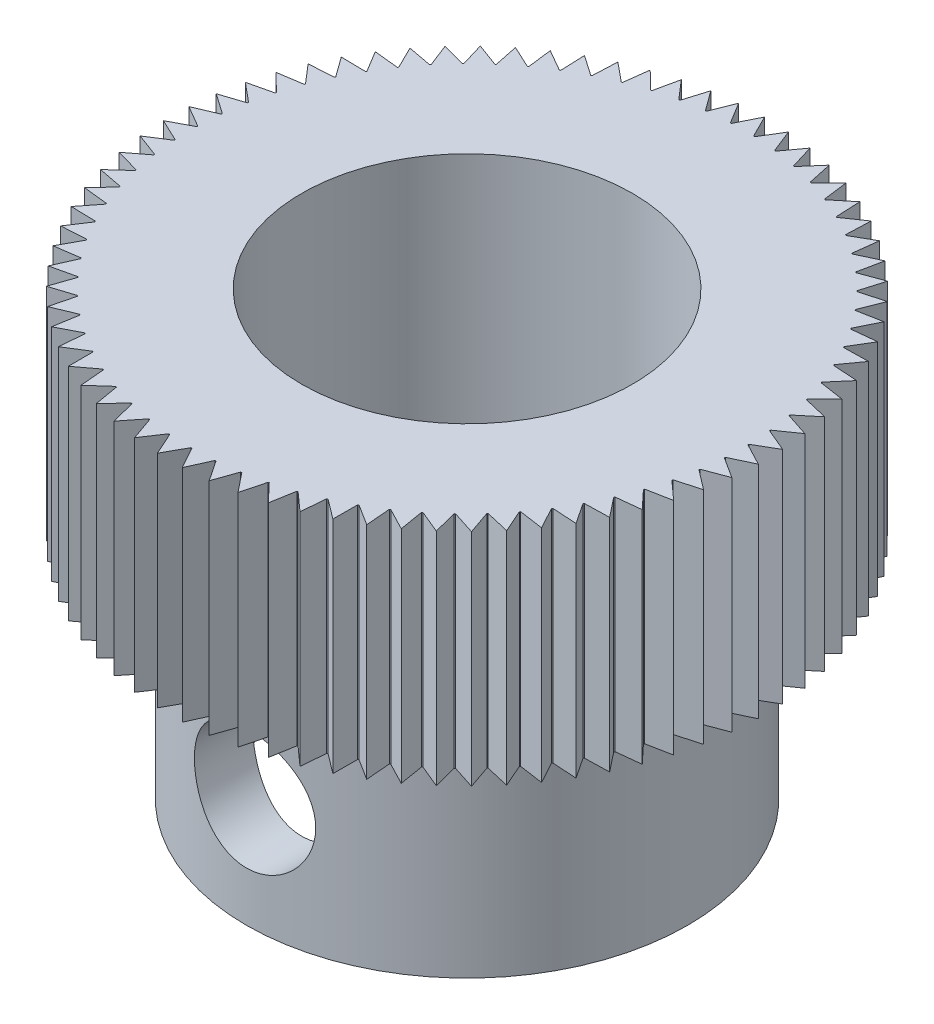
from build123d import *

# Parameters (mm, degrees)
SKETCH1_R           = 5
BOSS_EXTRUDE1_DEPTH = 4
BOSS_EXTRUDE2_DEPTH = 4
SKETCH5_R           = 4
BOSS_EXTRUDE3_DEPTH = 4
SKETCH7_R           = 3
CUT_EXTRUDE2_DEPTH  = 12.055352878
SKETCH_2_R          = 1.1
CUT_EXTRUDE_1_DEPTH = 12.549407536


with BuildPart() as part:
    # Sketch1 → Boss-Extrude1 (new body)
    with BuildSketch(Plane(origin=(0, 0, 0), x_dir=(1, 0, 0), z_dir=(0, 1, 0))):
        with Locations(Location((0, 0, 0), (0, 0, 270))):
            Circle(SKETCH1_R)
    extrude(amount=BOSS_EXTRUDE1_DEPTH)

    # Sketch3 → Boss-Extrude2 (add)
    with BuildSketch(Plane(origin=(0, 4, 0), x_dir=(1, 0, 0), z_dir=(0, 1, 0))):
        Polygon((-0.2, 4.995998399), (0.2, 4.995998399), (0, 5.395998399), align=None)
        Polygon((0.218755799, 4.995212298), (0.451525509, 5.377073873), (0.617352943, 4.96174116), align=None)
        Polygon((0.635977184, 4.959388372), (0.89988389, 5.320433037), (1.030375599, 4.892680873), align=None)
        Polygon((1.048737646, 4.888777899), (1.341930233, 5.226473186), (1.43617091, 4.789301945), align=None)
        Polygon((1.454141966, 4.783876163), (1.774563899, 5.095853382), (1.831892515, 4.652329504), align=None)
        Polygon((1.849346526, 4.645418972), (2.194750275, 4.929489827), (2.214764709, 4.482724315), align=None)
        Polygon((2.231579248, 4.474377505), (2.599542054, 4.728549442), (2.58210192, 4.281676035), align=None)
        Polygon((2.598159046, 4.271951495), (2.986099914, 4.494441681), (2.931327542, 4.050594875), align=None)
        Polygon((2.946514624, 4.039560814), (3.351712428, 4.228808641), (3.259992007, 3.791101702), align=None)
        Polygon((3.27420252, 3.778835516), (3.693815087, 3.933513546), (3.565789971, 3.505016674), align=None)
        Polygon((3.578924237, 3.491604403), (4.010008288, 3.61062768), (3.846576479, 3.194346473), align=None)
        Polygon((3.858542372, 3.179882193), (4.298074162, 3.262415856), (4.100382018, 2.861270226), align=None)
        Polygon((4.111095605, 2.845855395), (4.555992134, 2.891320528), (4.325426323, 2.508124225), align=None)
        Polygon((4.334812456, 2.491866965), (4.781953094, 2.499944664), (4.52013087, 2.137385534), align=None)
        Polygon((4.528123712, 2.12039988), (4.97437209, 2.091033484), (4.683129946, 1.751654619), align=None)
        Polygon((4.689673434, 1.734059712), (5.131899439, 1.667455207), (4.813280231, 1.353637106), align=None)
        Polygon((4.818328466, 1.335556362), (5.253430201, 1.232180929), (4.909668814, 0.946124801), align=None)
        Polygon((4.913186386, 0.927685043), (5.338111925, 0.788263788), (4.971619597, 0.53197611), align=None)
        Polygon((4.973581833, 0.513306681), (5.385350628, 0.338817543), (4.998698041, 0.114095989), align=None)
        Polygon((4.999091178, 0.09532784), (5.394814967, -0.113005264), (4.99071421, -0.304584433), align=None)
        Polygon((4.989535489, -0.323319656), (5.366438555, -0.56403542), (4.947724104, -0.721128414), align=None)
        Polygon((4.944981795, -0.739699297), (5.300420432, -1.011109273), (4.870029269, -1.132614198), align=None)
        Polygon((4.865742606, -1.15089048), (5.197223668, -1.451090921), (4.758174677, -1.536155507), align=None)
        Polygon((4.752373728, -1.554008992), (5.057572114, -1.880894209), (4.612944909, -1.928921788), align=None)
        Polygon((4.605670364, -1.946227248), (4.882445326, -2.297504375), (4.435358647, -2.308158069), align=None)
        Polygon((4.426661531, -2.324794119), (4.673071692, -2.697999199), (4.226661531, -2.67120428), align=None)
        Polygon((4.216602847, -2.687054228), (4.430919818, -3.079569497), (3.98831742, -3.015513912), align=None)
        Polygon((3.976967725, -3.030466584), (4.157688224, -3.439538828), (3.721998129, -3.338671881), align=None)
        Polygon((3.709437031, -3.352622393), (3.855293435, -3.775382265), (3.429571695, -3.638411465), align=None)
        Polygon((3.415887302, -3.651261965), (3.525856533, -4.084744108), (3.11308928, -3.912630207), align=None)
        Polygon((3.098377578, -3.924290558), (3.17168828, -4.365454406), (2.77477078, -4.159404659), align=None)
        Polygon((2.759134961, -4.169793072), (2.795272913, -4.615544178), (2.416989257, -4.377003876), align=None)
        Polygon((2.400538995, -4.386047484), (2.399250715, -4.833259224), (2.042254291, -4.563901556), align=None)
        Polygon((2.025104973, -4.571536924), (1.986399497, -5.017072429), (1.653194379, -4.718786745), align=None)
        Polygon((1.635466294, -4.724960317), (1.559615113, -5.165694476), (1.252538495, -4.840573036), align=None)
        Polygon((1.234355995, -4.845241509), (1.121891151, -5.278082887), (0.843096954, -4.928406185), align=None)
        Polygon((0.824587574, -4.931536812), (0.676297928, -5.35344934), (0.427741694, -4.981670106), align=None)
        Polygon((0.409035265, -4.983240929), (0.22596096, -5.391265191), (0.009386133, -4.99999119), align=None)
        Polygon((-0.009386133, -4.99999119), (-0.22596096, -5.391265191), (-0.409035265, -4.983240929), align=None)
        Polygon((-0.427741694, -4.981670106), (-0.676297928, -5.35344934), (-0.824587574, -4.931536812), align=None)
        Polygon((-0.843096954, -4.928406185), (-1.121891151, -5.278082887), (-1.234355995, -4.845241509), align=None)
        Polygon((-1.252538495, -4.840573036), (-1.559615113, -5.165694476), (-1.635466294, -4.724960317), align=None)
        Polygon((-1.653194379, -4.718786745), (-1.986399497, -5.017072429), (-2.025104973, -4.571536924), align=None)
        Polygon((-2.042254291, -4.563901556), (-2.399250715, -4.833259224), (-2.400538995, -4.386047484), align=None)
        Polygon((-2.416989257, -4.377003876), (-2.795272913, -4.615544178), (-2.759134961, -4.169793072), align=None)
        Polygon((-2.77477078, -4.159404659), (-3.17168828, -4.365454406), (-3.098377578, -3.924290558), align=None)
        Polygon((-3.11308928, -3.912630207), (-3.525856533, -4.084744108), (-3.415887302, -3.651261965), align=None)
        Polygon((-3.429571695, -3.638411465), (-3.855293435, -3.775382265), (-3.709437031, -3.352622393), align=None)
        Polygon((-3.721998129, -3.338671881), (-4.157688224, -3.439538828), (-3.976967725, -3.030466584), align=None)
        Polygon((-3.98831742, -3.015513912), (-4.430919818, -3.079569497), (-4.216602847, -2.687054228), align=None)
        Polygon((-4.226661531, -2.67120428), (-4.673071692, -2.697999199), (-4.426661531, -2.324794119), align=None)
        Polygon((-4.435358647, -2.308158069), (-4.882445326, -2.297504375), (-4.605670364, -1.946227248), align=None)
        Polygon((-4.612944909, -1.928921788), (-5.057572114, -1.880894209), (-4.752373728, -1.554008992), align=None)
        Polygon((-4.758174677, -1.536155507), (-5.197223668, -1.451090921), (-4.865742606, -1.15089048), align=None)
        Polygon((-4.870029269, -1.132614198), (-5.300420432, -1.011109273), (-4.944981795, -0.739699297), align=None)
        Polygon((-4.947724104, -0.721128414), (-5.366438555, -0.56403542), (-4.989535489, -0.323319656), align=None)
        Polygon((-4.99071421, -0.304584433), (-5.394814967, -0.113005264), (-4.999091178, 0.09532784), align=None)
        Polygon((-4.998698041, 0.114095989), (-5.385350628, 0.338817543), (-4.973581833, 0.513306681), align=None)
        Polygon((-4.971619597, 0.53197611), (-5.338111925, 0.788263788), (-4.913186386, 0.927685043), align=None)
        Polygon((-4.909668814, 0.946124801), (-5.253430201, 1.232180929), (-4.818328466, 1.335556362), align=None)
        Polygon((-4.813280231, 1.353637106), (-5.131899439, 1.667455207), (-4.689673434, 1.734059712), align=None)
        Polygon((-4.683129946, 1.751654619), (-4.97437209, 2.091033484), (-4.528123712, 2.12039988), align=None)
        Polygon((-4.52013087, 2.137385534), (-4.781953094, 2.499944664), (-4.334812456, 2.491866965), align=None)
        Polygon((-4.325426323, 2.508124225), (-4.555992134, 2.891320528), (-4.111095605, 2.845855395), align=None)
        Polygon((-4.100382018, 2.861270226), (-4.298074162, 3.262415856), (-3.858542372, 3.179882193), align=None)
        Polygon((-3.846576479, 3.194346473), (-4.010008288, 3.61062768), (-3.578924237, 3.491604403), align=None)
        Polygon((-3.565789971, 3.505016674), (-3.693815087, 3.933513546), (-3.27420252, 3.778835516), align=None)
        Polygon((-3.259992007, 3.791101702), (-3.351712428, 4.228808641), (-2.946514624, 4.039560814), align=None)
        Polygon((-2.931327542, 4.050594875), (-2.986099914, 4.494441681), (-2.598159046, 4.271951495), align=None)
        Polygon((-2.58210192, 4.281676035), (-2.599542054, 4.728549442), (-2.231579248, 4.474377505), align=None)
        Polygon((-2.214764709, 4.482724315), (-2.194750275, 4.929489827), (-1.849346526, 4.645418972), align=None)
        Polygon((-1.831892515, 4.652329504), (-1.774563899, 5.095853382), (-1.454141966, 4.783876163), align=None)
        Polygon((-1.43617091, 4.789301945), (-1.341930233, 5.226473186), (-1.048737646, 4.888777899), align=None)
        Polygon((-1.030375599, 4.892680873), (-0.89988389, 5.320433037), (-0.635977184, 4.959388372), align=None)
        Polygon((-0.617352943, 4.96174116), (-0.451525509, 5.377073873), (-0.218755799, 4.995212298), align=None)
    extrude(amount=-BOSS_EXTRUDE2_DEPTH)

    # Sketch5 → Boss-Extrude3 (add)
    with BuildSketch(Plane(origin=(0, 0, 0), x_dir=(-1, 0, 0), z_dir=(0, -1, 0))):
        with Locations(Location((0, 0, 0), (0, 0, 270))):
            Circle(SKETCH5_R)
    extrude(amount=BOSS_EXTRUDE3_DEPTH)

    # Sketch7 → Cut-Extrude2 (cut, through all)
    with BuildSketch(Plane(origin=(0, -4, 0), x_dir=(-1, 0, 0), z_dir=(0, -1, 0))):
        with Locations(Location((0, 0, 0), (0, 0, 90))):
            Circle(SKETCH7_R)
    extrude(amount=-CUT_EXTRUDE2_DEPTH, mode=Mode.SUBTRACT)

    # 草图2 → 切除-拉伸1 (cut, through all)
    with BuildSketch(Plane.XY.offset(4)):
        with Locations((0, -2)):
            Circle(SKETCH_2_R)
    extrude(amount=-CUT_EXTRUDE_1_DEPTH, mode=Mode.SUBTRACT)


solid = part.part
